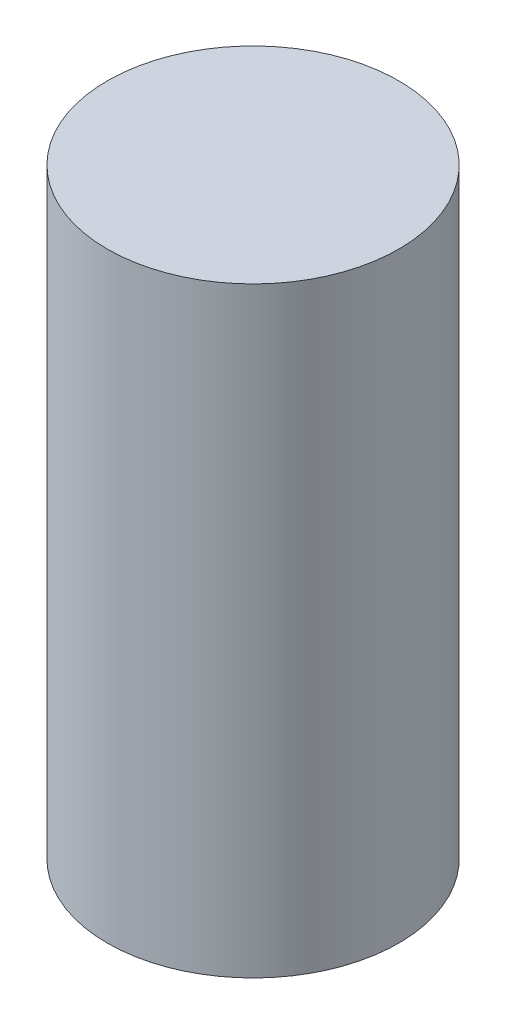
from build123d import *

# Parameters (mm, degrees)
SKETCH_1_R      = 4.85
EXTRUDE_1_DEPTH = 20


with BuildPart() as part:
    # 草图1 → 凸台-拉伸1 (new body)
    with BuildSketch(Plane(origin=(0, 0, 0), x_dir=(1, 0, 0), z_dir=(0, 1, 0))):
        with Locations(Location((0, 0, 0), (0, 0, 270))):
            Circle(SKETCH_1_R)
    extrude(amount=EXTRUDE_1_DEPTH)


solid = part.part
